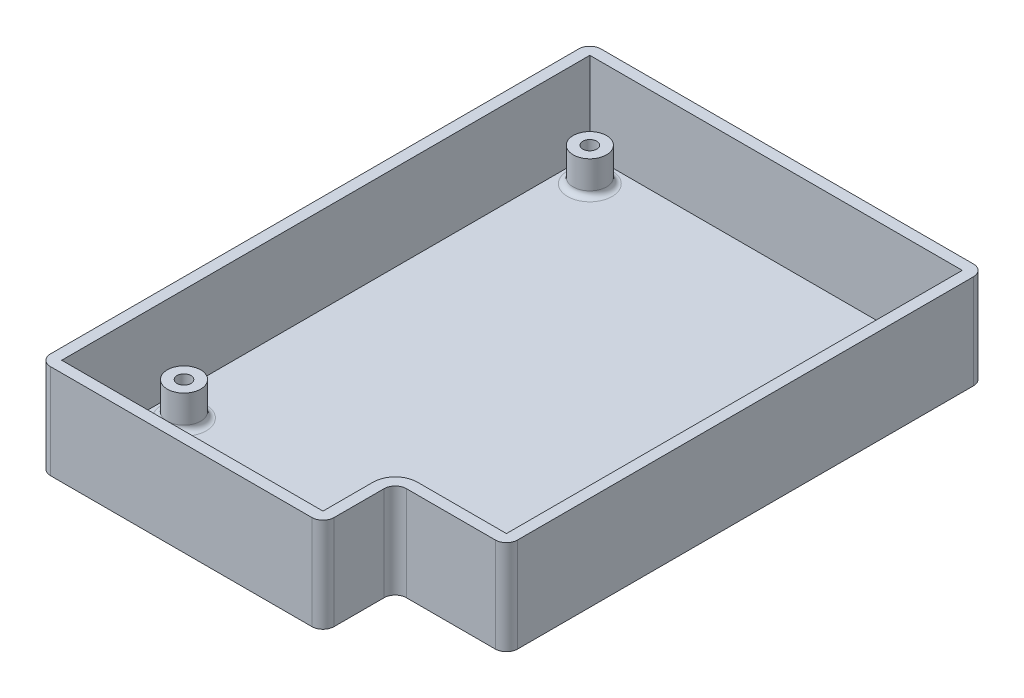
from build123d import *

# Parameters (mm, degrees)
BOSS_EXTRUDE1_DEPTH = 1.5
SKETCH3_R           = 3
SKETCH3_R_2         = 1.25
BOSS_EXTRUDE3_DEPTH = 6
FILLET2_R           = 1
BOSS_EXTRUDE5_DEPTH = 15.5
FILLET6_R           = 2
FILLET7_R           = 4


with BuildPart() as part:
    # Sketch1 → Boss-Extrude1 (new body)
    with BuildSketch(Plane(origin=(0, 0, 0), x_dir=(1, 0, 0), z_dir=(0, 1, 0))):
        Polygon((35.5, 43), (-35.5, 43), (-35.5, -56), (15.5, -56), (15.5, -43), (35.5, -43), align=None)
    extrude(amount=BOSS_EXTRUDE1_DEPTH)

    # Sketch3 → Boss-Extrude3 (add)
    # profile 1 of 4: a face of its own
    with BuildSketch(Plane(origin=(0, 1.5, 0), x_dir=(1, 0, 0), z_dir=(0, 1, 0))):
        with Locations(Location((-29, 36.5, 0), (0, 0, 270))):
            Circle(SKETCH3_R)
        with Locations(Location((-29, 36.5, 0), (0, 0, 270))):
            Circle(SKETCH3_R_2, mode=Mode.SUBTRACT)
    # profile 2 of 4: a face of its own
    with BuildSketch(Plane(origin=(0, 1.5, 0), x_dir=(1, 0, 0), z_dir=(0, 1, 0))):
        with Locations(Location((29, 36.5, 0), (0, 0, 90))):
            Circle(SKETCH3_R)
        with Locations(Location((29, 36.5, 0), (0, 0, 90))):
            Circle(SKETCH3_R_2, mode=Mode.SUBTRACT)
    # profile 3 of 4: a face of its own
    with BuildSketch(Plane(origin=(0, 1.5, 0), x_dir=(1, 0, 0), z_dir=(0, 1, 0))):
        with Locations(Location((29, -36.5, 0), (0, 0, 270))):
            Circle(SKETCH3_R)
        with Locations(Location((29, -36.5, 0), (0, 0, 270))):
            Circle(SKETCH3_R_2, mode=Mode.SUBTRACT)
    # profile 4 of 4: a face of its own
    with BuildSketch(Plane(origin=(0, 1.5, 0), x_dir=(1, 0, 0), z_dir=(0, 1, 0))):
        with Locations(Location((-29, -36.5, 0), (0, 0, 90))):
            Circle(SKETCH3_R)
        with Locations(Location((-29, -36.5, 0), (0, 0, 90))):
            Circle(SKETCH3_R_2, mode=Mode.SUBTRACT)
    extrude(amount=BOSS_EXTRUDE3_DEPTH)

    # Fillet2
    fillet2_edges = [part.edges().sort_by_distance(p)[0] for p in [
        (-29, 1.5, -39.5),
        (29, 1.5, -33.5),
        (29, 1.5, 33.5),
        (-29, 1.5, 39.5),
    ]]
    fillet(fillet2_edges, radius=FILLET2_R)

    # Sketch5 → Boss-Extrude5 (add)
    with BuildSketch(Plane(origin=(0, 1.5, 0), x_dir=(1, 0, 0), z_dir=(0, 1, 0))):
        Polygon((-35.5, 43), (-35.5, -56), (15.5, -56), (15.5, -43), (35.5, -43), (35.5, 43), align=None)
        Polygon((-33.5, 41), (-33.5, -54), (13.5, -54), (13.5, -41), (33.5, -41), (33.5, 41), align=None, mode=Mode.SUBTRACT)
    extrude(amount=BOSS_EXTRUDE5_DEPTH)

    # Fillet6
    fillet6_edges = [part.edges().sort_by_distance(p)[0] for p in [
        (-35.5, 8.5, -43),
        (35.5, 8.5, -43),
        (35.5, 8.5, 43),
        (15.5, 8.5, 43),
        (15.5, 8.5, 56),
        (-35.5, 8.5, 56),
    ]]
    fillet(fillet6_edges, radius=FILLET6_R)

    # Fillet7
    fillet7_edges = [part.edges().sort_by_distance(p)[0] for p in [
        (13.5, 9.25, 41),
    ]]
    fillet(fillet7_edges, radius=FILLET7_R)


solid = part.part
